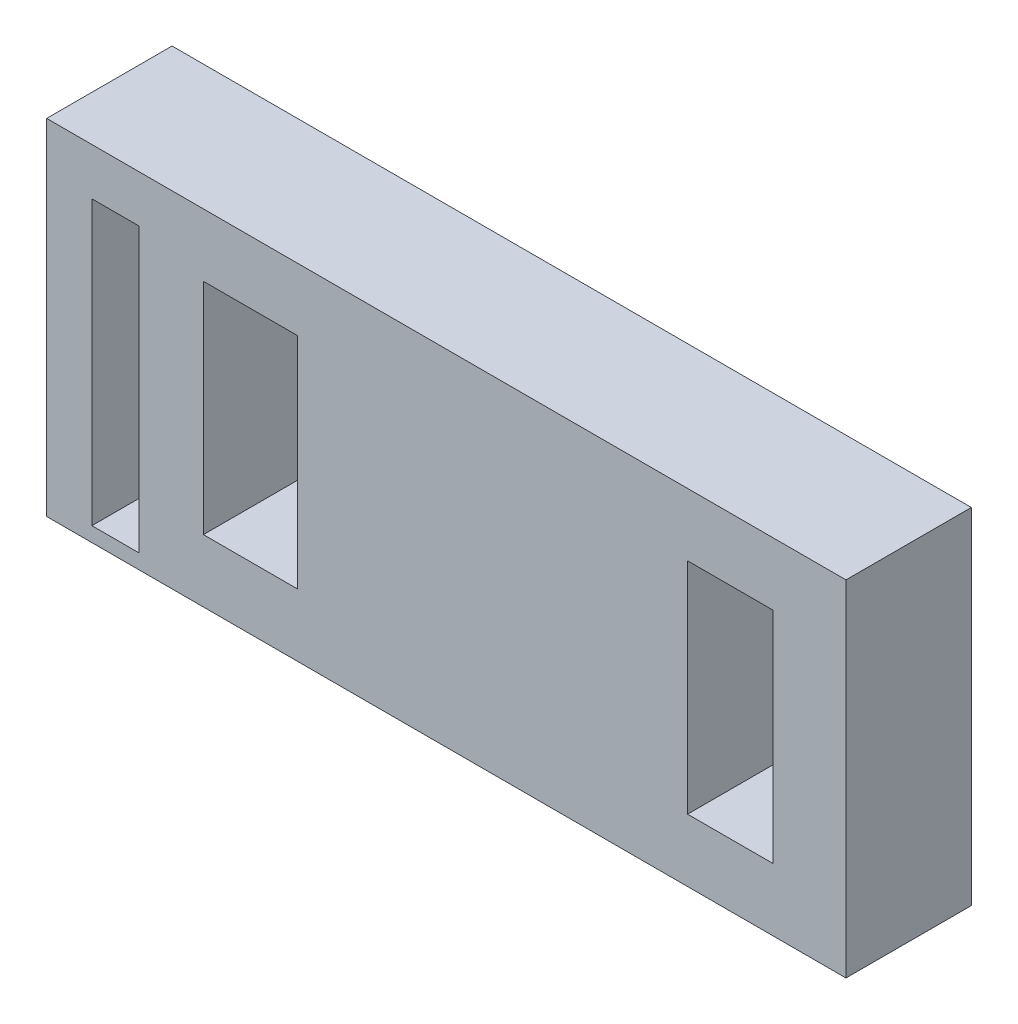
from build123d import *

# Parameters (mm, degrees)
SKETCH1_W           = 255
SKETCH1_H           = 110
BOSS_EXTRUDE1_DEPTH = 40
SKETCH2_W           = 30
SKETCH2_H           = 70
SKETCH2_W_2         = 15
SKETCH2_H_2         = 90.315630228
SKETCH2_W_3         = 27.270702046
CUT_EXTRUDE1_DEPTH  = 30


with BuildPart() as part:
    # Sketch1 → Boss-Extrude1 (new body)
    with BuildSketch(Plane.XY):
        with Locations((-7.252293578, -0.02293578)):
            Rectangle(SKETCH1_W, SKETCH1_H)
    extrude(amount=BOSS_EXTRUDE1_DEPTH)

    # Sketch2 → Cut-Extrude1 (cut)
    with BuildSketch(Plane.XY.offset(40)):
        with Locations((-69.752293578, -0.02293578)):
            Rectangle(SKETCH2_W, SKETCH2_H)
        with Locations((-112.830305265, -5.180750894)):
            Rectangle(SKETCH2_W_2, SKETCH2_H_2)
        with Locations((83.351991075, -0.02293578)):
            Rectangle(SKETCH2_W_3, SKETCH2_H)
    extrude(amount=-CUT_EXTRUDE1_DEPTH, mode=Mode.SUBTRACT)


solid = part.part
